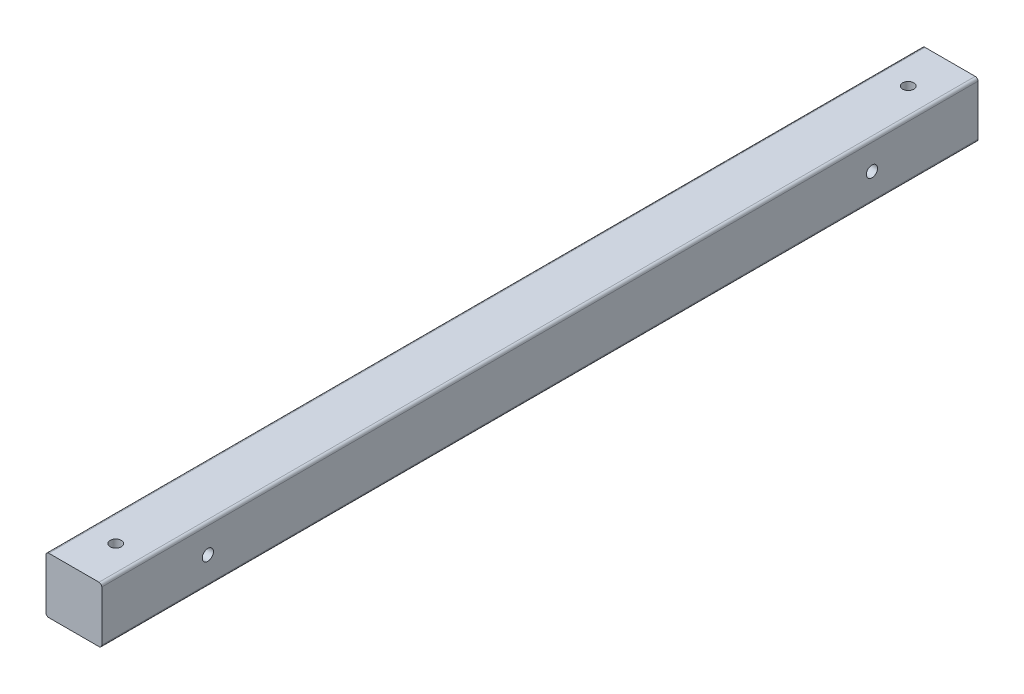
from build123d import *

# Parameters (mm, degrees)
SKETCH_1_W          = 20
SKETCH_1_H          = 20
EXTRUDE_1_DEPTH     = 314
SKETCH_2_R          = 2
CUT_EXTRUDE_1_DEPTH = 314
FILLET_1_R          = 1
SKETCH_3_R          = 2
CUT_EXTRUDE_2_DEPTH = 20


with BuildPart() as part:
    # 草图1 → 凸台-拉伸1 (new body)
    with BuildSketch(Plane.XY):
        with Locations((10, 10)):
            Rectangle(SKETCH_1_W, SKETCH_1_H)
    extrude(amount=EXTRUDE_1_DEPTH)

    # 草图2 → 切除-拉伸1 (cut)
    with BuildSketch(Plane(origin=(0, 20, 0), x_dir=(1, 0, 0), z_dir=(0, 1, 0))):
        with Locations(Location((10, -15, 0), (0, 0, 270))):
            Circle(SKETCH_2_R)
        with Locations(Location((10, -299, 0), (0, 0, 270))):
            Circle(SKETCH_2_R)
    extrude(amount=-CUT_EXTRUDE_1_DEPTH, mode=Mode.SUBTRACT)

    # 圆角1
    fillet_1_edges = [part.edges().sort_by_distance(p)[0] for p in [
        (0, 20, 157),
        (20, 20, 157),
        (20, 0, 157),
        (0, 0, 157),
    ]]
    fillet(fillet_1_edges, radius=FILLET_1_R)

    # 草图3 → 切除-拉伸2 (cut)
    with BuildSketch(Plane.ZY):
        with Locations((38, 10)):
            Circle(SKETCH_3_R)
        with Locations((276, 10)):
            Circle(SKETCH_3_R)
    extrude(amount=-CUT_EXTRUDE_2_DEPTH, mode=Mode.SUBTRACT)


solid = part.part
